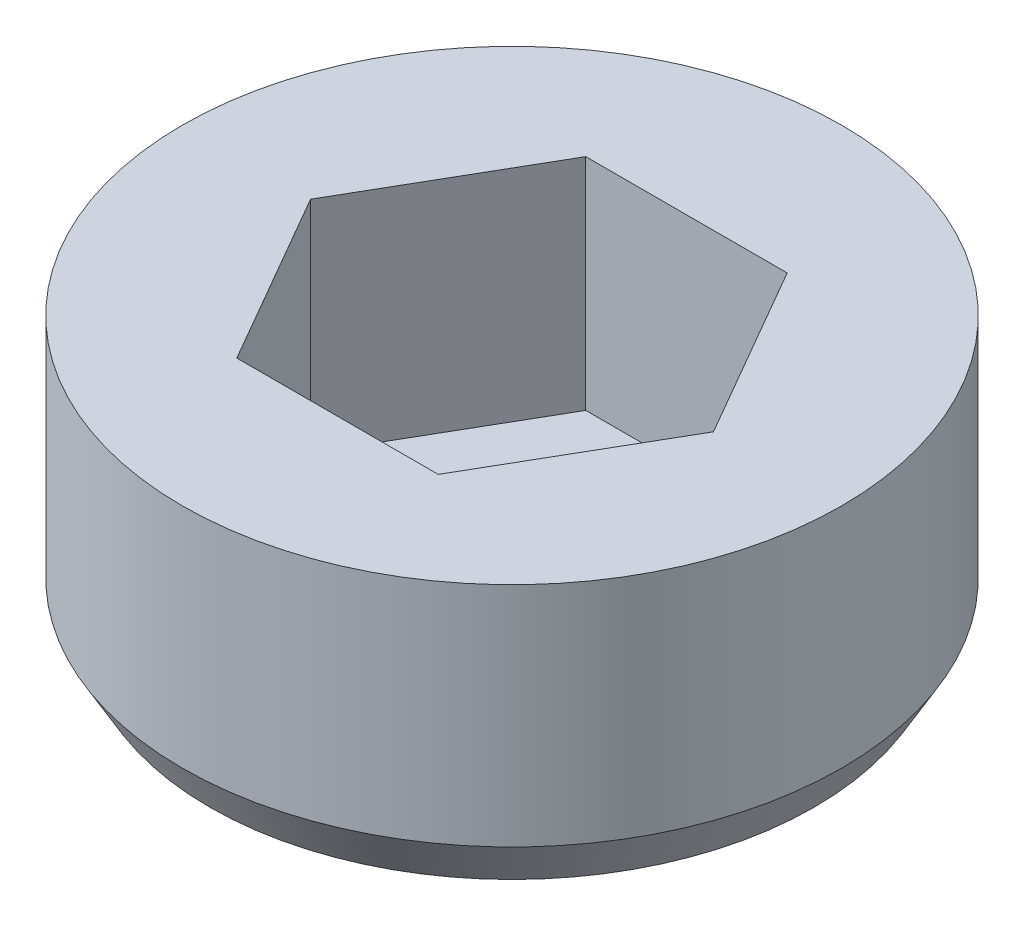
from build123d import *

# Parameters (mm, degrees)
SKETCH1_R           = 12
SKETCH1_R_2         = 3.1
BOSS_EXTRUDE1_DEPTH = 10
CUT_EXTRUDE1_DEPTH  = 8
CHAMFER1_SIZE       = 1
CHAMFER1_SIZE2      = 1.732050808


with BuildPart() as part:
    # Sketch1 → Boss-Extrude1 (new body)
    with BuildSketch(Plane(origin=(0, 0, 0), x_dir=(1, 0, 0), z_dir=(0, 1, 0))):
        with Locations(Location((0, 0, 0), (0, 0, 270))):
            Circle(SKETCH1_R)
        with Locations(Location((0, 0, 0), (0, 0, 270))):
            Circle(SKETCH1_R_2, mode=Mode.SUBTRACT)
    extrude(amount=BOSS_EXTRUDE1_DEPTH)

    # Sketch2 → Cut-Extrude1 (cut)
    with BuildSketch(Plane(origin=(0, 10, 0), x_dir=(1, 0, 0), z_dir=(0, 1, 0))):
        Polygon((7.332348419, 0), (3.666174209, 6.35), (-3.666174209, 6.35), (-7.332348419, 0), (-3.666174209, -6.35), (3.666174209, -6.35), align=None)
    extrude(amount=-CUT_EXTRUDE1_DEPTH, mode=Mode.SUBTRACT)

    # Chamfer1
    chamfer1_edges = [part.edges().sort_by_distance(p)[0] for p in [
        (0, 0, -12),
    ]]
    chamfer1_side = [part.faces().sort_by_distance(p)[0] for p in [
        (0, 0, -11.660588745),
    ]]
    chamfer(chamfer1_edges, length=CHAMFER1_SIZE, length2=CHAMFER1_SIZE2, reference=chamfer1_side[0])


solid = part.part
